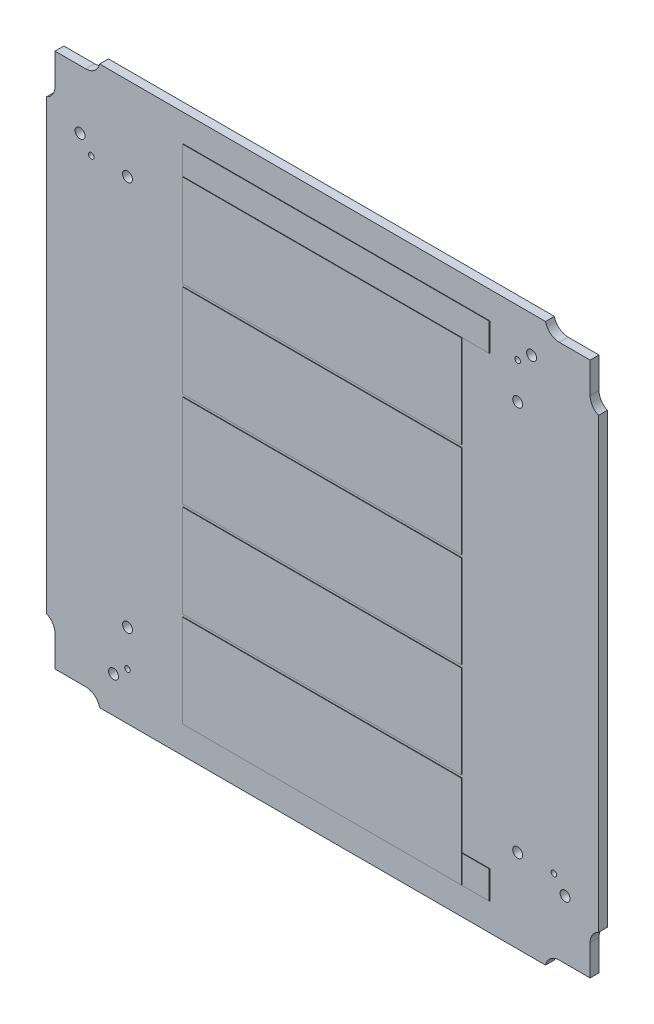
from build123d import *

# Parameters (mm, degrees)
SKETCH1_W                      = 99
SKETCH1_H                      = 100
BOSS_EXTRUDE1_DEPTH            = 1.5875
CUT_EXTRUDE1_DEPTH             = 71.375920287
CUT_EXTRUDE2_DEPTH             = 71.375920287
CUT_EXTRUDE3_DEPTH             = 71.375920287
CUT_EXTRUDE4_DEPTH             = 71.375920287
CUT_EXTRUDE5_DEPTH             = 71.375920287
CUT_EXTRUDE6_DEPTH             = 71.375920287
CUT_EXTRUDE7_DEPTH             = 71.375920287
CUT_EXTRUDE8_DEPTH             = 71.375920287
SKETCH10_W                     = 50
SKETCH10_H                     = 16.6
BOSS_EXTRUDE2_DEPTH            = 0.1
SKETCH11_W                     = 50
SKETCH11_H                     = 16.6
BOSS_EXTRUDE3_DEPTH            = 0.1
SKETCH12_W                     = 50
SKETCH12_H                     = 16.6
BOSS_EXTRUDE4_DEPTH            = 0.1
SKETCH13_W                     = 50
SKETCH13_H                     = 16.6
BOSS_EXTRUDE5_DEPTH            = 0.1
SKETCH14_W                     = 50
SKETCH14_H                     = 16.6
BOSS_EXTRUDE6_DEPTH            = 0.1
SKETCH15_W                     = 55
SKETCH15_H                     = 5
BOSS_EXTRUDE7_DEPTH            = 0.1
SKETCH16_W                     = 4.9
SKETCH16_H                     = 5
BOSS_EXTRUDE8_DEPTH            = 0.1
F_000_CLEARANCE_HOLE1_D        = 1
F_000_CLEARANCE_HOLE2_D        = 1
F_000_CLEARANCE_HOLE2_DEPTH    = 1.6875
F_50_0_07_DIAMETER_HOLE1_D     = 1.778
F_50_0_07_DIAMETER_HOLE1_DEPTH = 1.6875
F_50_0_07_DIAMETER_HOLE2_D     = 1.778


with BuildPart() as part:
    # Sketch1 → Boss-Extrude1 (new body)
    with BuildSketch(Plane.XY.offset(1.5875)):
        Rectangle(SKETCH1_W, SKETCH1_H)
    extrude(amount=-BOSS_EXTRUDE1_DEPTH)

    # Sketch2 → Cut-Extrude1 (cut, through all)
    with BuildSketch(Plane(origin=(0, 0, 0), x_dir=(-1, 0, 0), z_dir=(0, 0, -1))):
        with BuildLine():
            Line((48, -42.481934729), (48, -50))
            Line((48, -50), (49.5, -50))
            Line((49.5, -50), (49.5, -40.164608684))
            ThreePointArc((49.5, -40.164608684), (48.40772422, -41.101717355), (48, -42.481934729))
        make_face()
    extrude(amount=-CUT_EXTRUDE1_DEPTH, mode=Mode.SUBTRACT)

    # Sketch3 → Cut-Extrude2 (cut, through all)
    with BuildSketch(Plane(origin=(0, 0, 0), x_dir=(-1, 0, 0), z_dir=(0, 0, -1))):
        with BuildLine():
            Line((48, -48), (42.481934729, -48))
            ThreePointArc((42.481934729, -48), (40.888196984, -48.562223471), (40, -50))
            Line((40, -50), (48, -50))
            Line((48, -50), (48, -48))
        make_face()
    extrude(amount=-CUT_EXTRUDE2_DEPTH, mode=Mode.SUBTRACT)

    # Sketch4 → Cut-Extrude3 (cut, through all)
    with BuildSketch(Plane(origin=(0, 0, 0), x_dir=(-1, 0, 0), z_dir=(0, 0, -1))):
        with BuildLine():
            Line((-42.481934729, -48), (-49.5, -48))
            Line((-49.5, -48), (-49.5, -50))
            Line((-49.5, -50), (-40, -50))
            ThreePointArc((-40, -50), (-40.888196984, -48.562223471), (-42.481934729, -48))
        make_face()
    extrude(amount=-CUT_EXTRUDE3_DEPTH, mode=Mode.SUBTRACT)

    # Sketch5 → Cut-Extrude4 (cut, through all)
    with BuildSketch(Plane(origin=(0, 0, 0), x_dir=(-1, 0, 0), z_dir=(0, 0, -1))):
        with BuildLine():
            Line((-48, -48), (-48, -42.481934729))
            ThreePointArc((-48, -42.481934729), (-48.40772422, -41.101717355), (-49.5, -40.164608684))
            Line((-49.5, -40.164608684), (-49.5, -48))
            Line((-49.5, -48), (-48, -48))
        make_face()
    extrude(amount=-CUT_EXTRUDE4_DEPTH, mode=Mode.SUBTRACT)

    # Sketch6 → Cut-Extrude5 (cut, through all)
    with BuildSketch(Plane(origin=(0, 0, 0), x_dir=(-1, 0, 0), z_dir=(0, 0, -1))):
        with BuildLine():
            Line((-48, 42.481934729), (-48, 50))
            Line((-48, 50), (-49.5, 50))
            Line((-49.5, 50), (-49.5, 40.164608684))
            ThreePointArc((-49.5, 40.164608684), (-48.40772422, 41.101717355), (-48, 42.481934729))
        make_face()
    extrude(amount=-CUT_EXTRUDE5_DEPTH, mode=Mode.SUBTRACT)

    # Sketch7 → Cut-Extrude6 (cut, through all)
    with BuildSketch(Plane(origin=(0, 0, 0), x_dir=(-1, 0, 0), z_dir=(0, 0, -1))):
        with BuildLine():
            Line((-48, 48), (-42.481934729, 48))
            ThreePointArc((-42.481934729, 48), (-40.888196984, 48.562223471), (-40, 50))
            Line((-40, 50), (-48, 50))
            Line((-48, 50), (-48, 48))
        make_face()
    extrude(amount=-CUT_EXTRUDE6_DEPTH, mode=Mode.SUBTRACT)

    # Sketch8 → Cut-Extrude7 (cut, through all)
    with BuildSketch(Plane(origin=(0, 0, 0), x_dir=(-1, 0, 0), z_dir=(0, 0, -1))):
        with BuildLine():
            Line((42.481934729, 48), (49.5, 48))
            Line((49.5, 48), (49.5, 50))
            Line((49.5, 50), (40, 50))
            ThreePointArc((40, 50), (40.888196984, 48.562223471), (42.481934729, 48))
        make_face()
    extrude(amount=-CUT_EXTRUDE7_DEPTH, mode=Mode.SUBTRACT)

    # Sketch9 → Cut-Extrude8 (cut, through all)
    with BuildSketch(Plane(origin=(0, 0, 0), x_dir=(-1, 0, 0), z_dir=(0, 0, -1))):
        with BuildLine():
            Line((48, 48), (48, 42.481934729))
            ThreePointArc((48, 42.481934729), (48.40772422, 41.101717355), (49.5, 40.164608684))
            Line((49.5, 40.164608684), (49.5, 48))
            Line((49.5, 48), (48, 48))
        make_face()
    extrude(amount=-CUT_EXTRUDE8_DEPTH, mode=Mode.SUBTRACT)

    # Sketch10 → Boss-Extrude2 (add)
    with BuildSketch(Plane.XY.offset(1.5875)):
        with Locations((0, 31.7)):
            Rectangle(SKETCH10_W, SKETCH10_H)
    extrude(amount=BOSS_EXTRUDE2_DEPTH)

    # Sketch11 → Boss-Extrude3 (add)
    with BuildSketch(Plane.XY.offset(1.5875)):
        with Locations((0, 14.6)):
            Rectangle(SKETCH11_W, SKETCH11_H)
    extrude(amount=BOSS_EXTRUDE3_DEPTH)

    # Sketch12 → Boss-Extrude4 (add)
    with BuildSketch(Plane.XY.offset(1.5875)):
        with Locations((0, -2.5)):
            Rectangle(SKETCH12_W, SKETCH12_H)
    extrude(amount=BOSS_EXTRUDE4_DEPTH)

    # Sketch13 → Boss-Extrude5 (add)
    with BuildSketch(Plane.XY.offset(1.5875)):
        with Locations((0, -19.6)):
            Rectangle(SKETCH13_W, SKETCH13_H)
    extrude(amount=BOSS_EXTRUDE5_DEPTH)

    # Sketch14 → Boss-Extrude6 (add)
    with BuildSketch(Plane.XY.offset(1.5875)):
        with Locations((0, -36.7)):
            Rectangle(SKETCH14_W, SKETCH14_H)
    extrude(amount=BOSS_EXTRUDE6_DEPTH)

    # Sketch15 → Boss-Extrude7 (add)
    with BuildSketch(Plane.XY.offset(1.5875)):
        with Locations((2.5, 42.6)):
            Rectangle(SKETCH15_W, SKETCH15_H)
    extrude(amount=BOSS_EXTRUDE7_DEPTH)

    # Sketch16 → Boss-Extrude8 (add)
    with BuildSketch(Plane.XY.offset(1.5875)):
        with Locations((27.55, -42.5)):
            Rectangle(SKETCH16_W, SKETCH16_H)
    extrude(amount=BOSS_EXTRUDE8_DEPTH)

    # #000 Clearance Hole1 (through all)
    with Locations(Plane.XY.offset(1.5875)):
        with Locations((41.5, -35)):
            Hole(F_000_CLEARANCE_HOLE1_D / 2)

    # #000 Clearance Hole2
    with Locations(Plane(origin=(0, 0, 0), x_dir=(-1, 0, 0), z_dir=(0, 0, -1))):
        with Locations((-35, 41.5), (35, -41.5), (41.5, 35)):
            Hole(F_000_CLEARANCE_HOLE2_D / 2, depth=F_000_CLEARANCE_HOLE2_DEPTH)

    # #50 (0.07) Diameter Hole1
    with Locations(Plane(origin=(0, 0, 0), x_dir=(-1, 0, 0), z_dir=(0, 0, -1))):
        with Locations((-35, 35), (-43.5, -37.5), (-35, -35), (37.5, -43.5), (35, -35), (43.5, 37.5), (35, 35)):
            Hole(F_50_0_07_DIAMETER_HOLE1_D / 2, depth=F_50_0_07_DIAMETER_HOLE1_DEPTH)

    # #50 (0.07) Diameter Hole2 (through all)
    with Locations(Plane.XY.offset(1.5875)):
        with Locations((37.5, 43.5)):
            Hole(F_50_0_07_DIAMETER_HOLE2_D / 2)


solid = part.part
